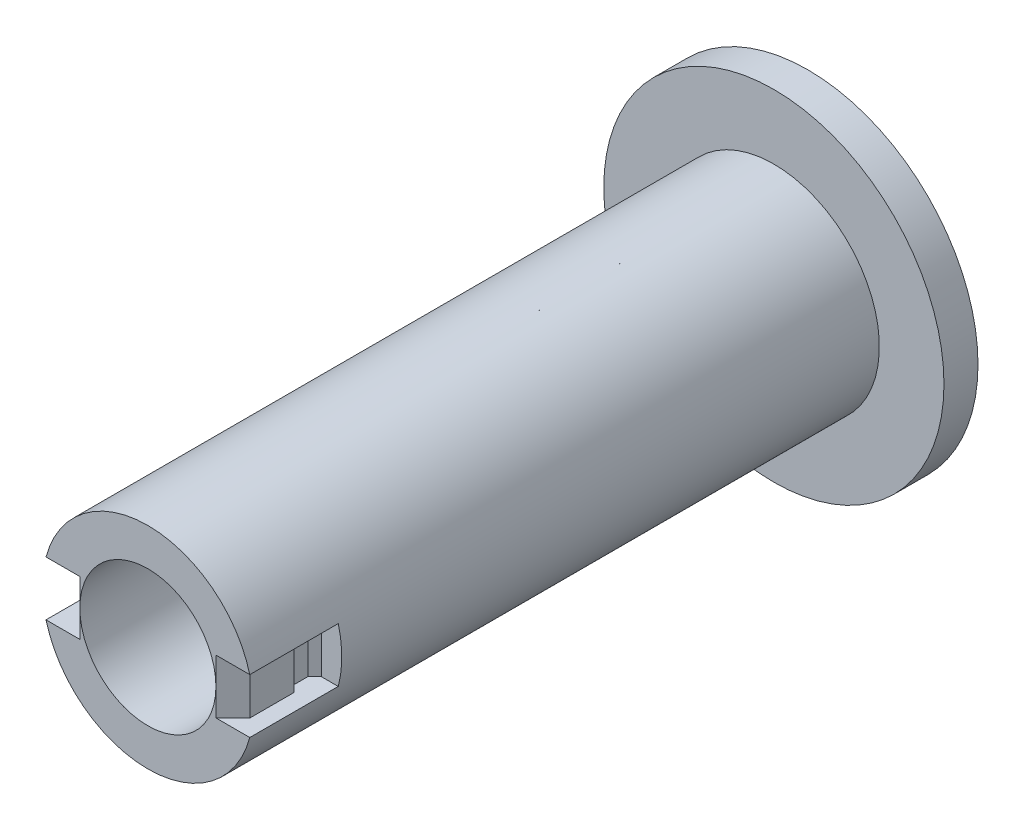
from build123d import *

# Parameters (mm, degrees)
AXLE_BASE_SKETCH_R        = 15.5
AXLE_DEPTH                = 92
GUARD_BASE_R              = 25
GUARD_DEPTH               = 5
INNER_AXLE_HOLE_BASE_R    = 10
INNER_AXLE_HOLE_DEPTH     = 104.242433137
COUPLING_TOOTH_HOLE_DEPTH = 4


with BuildPart() as part:
    # Axle base sketch → Axle (new body)
    with BuildSketch(Plane.XY):
        Circle(AXLE_BASE_SKETCH_R)
    extrude(amount=AXLE_DEPTH)

    # Guard base → Guard (add)
    with BuildSketch(Plane(origin=(0, 0, 0), x_dir=(-1, 0, 0), z_dir=(0, 0, -1))):
        Circle(GUARD_BASE_R)
    extrude(amount=GUARD_DEPTH)

    # Inner axle hole base → Inner axle hole (cut, through all)
    with BuildSketch(Plane.XY.offset(92)):
        Circle(INNER_AXLE_HOLE_BASE_R)
    extrude(amount=-INNER_AXLE_HOLE_DEPTH, mode=Mode.SUBTRACT)

    # Coupling tooth base → Coupling tooth hole (cut, symmetric)
    with BuildSketch(Plane(origin=(0, 0, 0), x_dir=(1, 0, 0), z_dir=(0, 1, 0))):
        Polygon((12.5, -89.5), (10, -92), (15.5, -92), (15.5, -79), (12.5, -79), (11.5, -80), (11.5, -82), (12.5, -83), align=None)
    coupling_tooth_hole = extrude(amount=COUPLING_TOOTH_HOLE_DEPTH, both=True, mode=Mode.SUBTRACT)

    # Coupling teeth: Coupling tooth hole across plane
    add(coupling_tooth_hole.mirror(Plane(origin=(0, 0, 0), x_dir=(0, 0, 1), z_dir=(1, 0, 0))), mode=Mode.SUBTRACT)


solid = part.part
